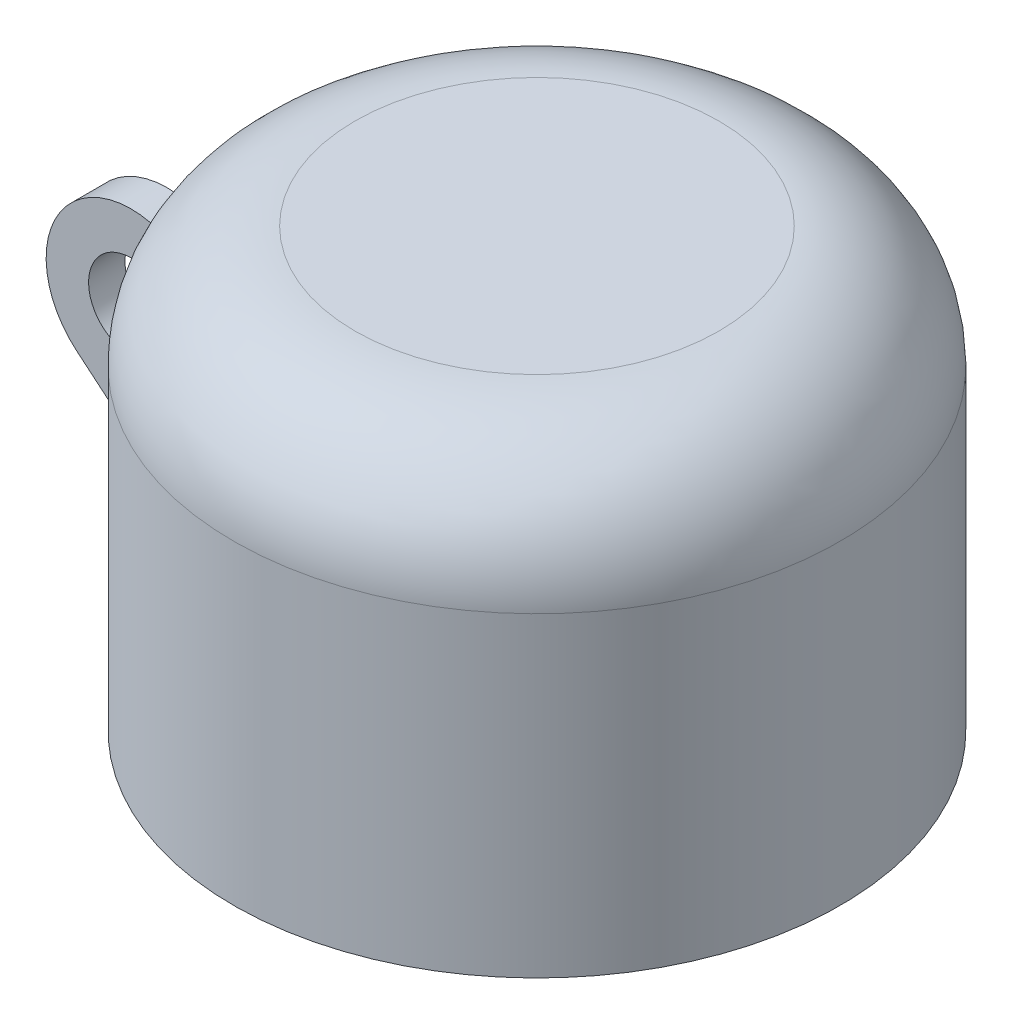
from build123d import *

# Parameters (mm, degrees)
SKETCH5_W                            = 3
SKETCH5_H                            = 26
BOSS_EXTRUDE1_DEPTH                  = 15
BOSS_EXTRUDE1_DIRECTION_2_REACH      = 68.491
BOSS_EXTRUDE1_DIRECTION_2_END_RADIUS = 25
CUT_EXTRUDE1_DEPTH                   = 60.338014797
CUT_EXTRUDE1_DEPTH_BACK              = 60.338014797
SKETCH4_R                            = 3.5


with BuildPart() as part:
    # Sketch1 → Revolve1 (revolve)
    with BuildSketch(Plane.XY, mode=Mode.PRIVATE) as revolve1_sk:
        with BuildLine():
            Line((0, 0), (25, 0))
            Line((25, 0), (25, 26))
            ThreePointArc((25, 26), (22.071067812, 33.071067812), (15, 36))
            Line((15, 36), (0, 36))
            Line((0, 36), (0, 35))
            Line((0, 35), (1, 35))
            Line((1, 35), (15, 35))
            ThreePointArc((15, 35), (21.363961031, 32.363961031), (24, 26))
            Line((24, 26), (24, 1))
            Line((24, 1), (1, 1))
            Line((1, 1), (0, 1))
            Line((0, 1), (0, 0))
        make_face()
    revolve(revolve1_sk.sketch.rotate(Axis((0, 36, 0), (0, -1, 0)), 180), axis=Axis((0, 36, 0), (0, -1, 0)))

    # Sketch5 → Boss-Extrude1 (add)
    with BuildSketch(Plane.ZY.offset(25)):
        with Locations((0, 13)):
            Rectangle(SKETCH5_W, SKETCH5_H)
    extrude(amount=BOSS_EXTRUDE1_DEPTH)

    # Boss-Extrude1 direction 2: up to this cylinder (the profile starts outside it)
    boss_extrude1_direction_2_end = Plane(origin=(0, 13, 0), z_dir=(0, 1, 0)) * Cylinder(BOSS_EXTRUDE1_DIRECTION_2_END_RADIUS, 187.982, mode=Mode.PRIVATE)
    # Sketch5 → Boss-Extrude1 direction 2 (add, up to the surface)
    with BuildSketch(Plane.ZY.offset(25), mode=Mode.PRIVATE) as boss_extrude1_direction_2_sk1:
        with Locations((0, 13)):
            Rectangle(SKETCH5_W, SKETCH5_H)
    boss_extrude1_direction_2_tool1 = extrude(boss_extrude1_direction_2_sk1.sketch, amount=-BOSS_EXTRUDE1_DIRECTION_2_REACH, mode=Mode.PRIVATE) - boss_extrude1_direction_2_end
    add(boss_extrude1_direction_2_tool1.solids().sort_by_distance((-25, 13, 0))[0])
    add(boss_extrude1_direction_2_tool1.solids().sort_by_distance((-25, 13, 0))[1])

    # Sketch4 → Cut-Extrude1 (cut, two sides: drawn at the far end of the back side and taken through both)
    with BuildSketch(Plane.XY.offset(-CUT_EXTRUDE1_DEPTH_BACK)):
        with Locations(Location((-31.954959427, 15, 0), (0, 0, 90))):
            Circle(SKETCH4_R)
        with BuildLine():
            Line((-24.954959427, 0), (-36.451309792, 9.635036496))
            ThreePointArc((-36.451309792, 9.635036496), (-34.915157684, 21.34328198), (-24.954959427, 15))
            Line((-24.954959427, 15), (-24.954959427, 26))
            Line((-24.954959427, 26), (-40, 26))
            Line((-40, 26), (-40, 0))
            Line((-40, 0), (-24.954959427, 0))
        make_face()
    extrude(amount=CUT_EXTRUDE1_DEPTH + CUT_EXTRUDE1_DEPTH_BACK, mode=Mode.SUBTRACT)


solid = part.part
